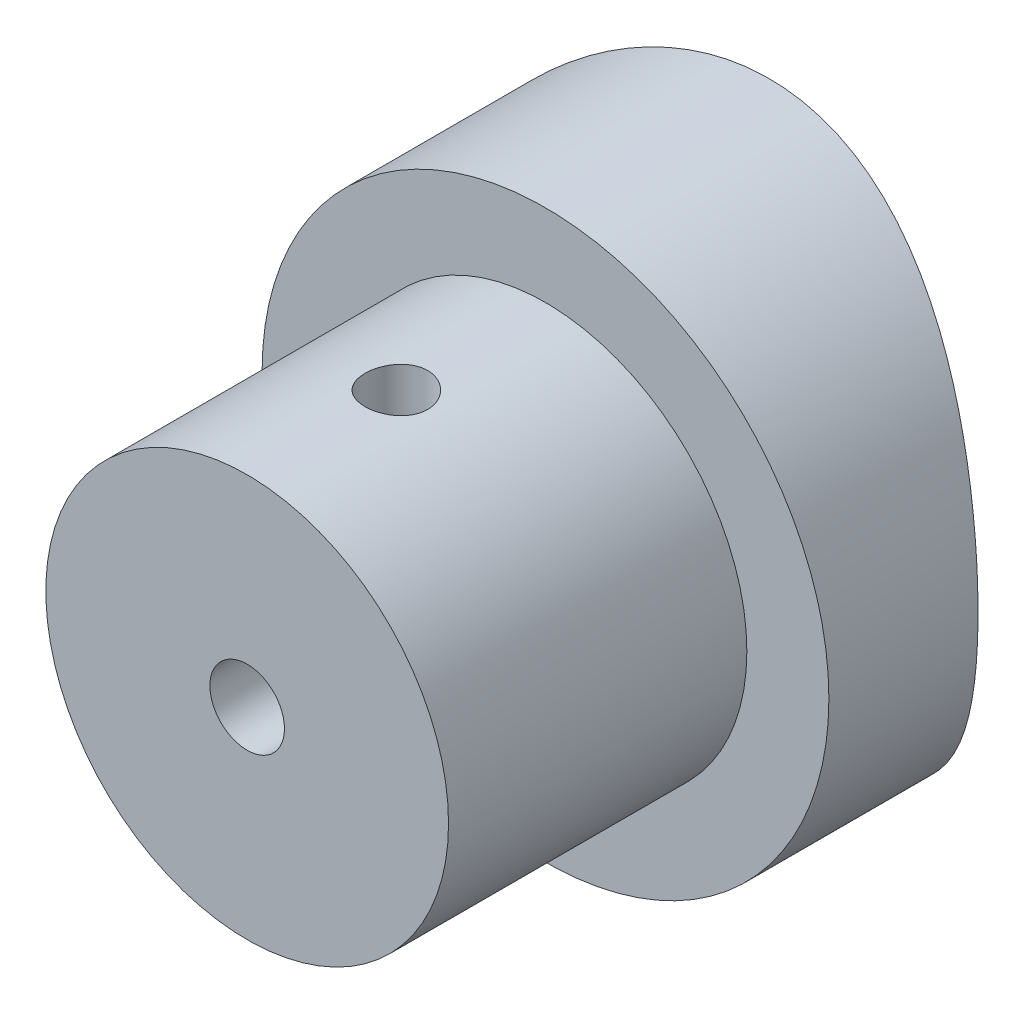
from build123d import *

# Parameters (mm, degrees)
ESBO_O1_R                  = 19
RESSALTO_EXTRUS_O1_DEPTH   = 7.5
CORTE_EXTRUS_O1_DEPTH      = 28.897132469
CORTE_EXTRUS_O1_DEPTH_BACK = 28.897132469
ESBO_O3_R                  = 13.5
RESSALTO_EXTRUS_O2_DEPTH   = 20
FURO_ROSCADO_DE_M61_D      = 5
FURO_ROSCADO_DE_M51_D      = 4.2
FURO_ROSCADO_DE_M51_DEPTH  = 10
FURO_ROSCADO_DE_M51_TIP    = 1.2618073


with BuildPart() as part:
    # Esboço1 → Ressalto-extrusão1 (new, symmetric)
    with BuildSketch(Plane.XY):
        Circle(ESBO_O1_R)
    extrude(amount=RESSALTO_EXTRUS_O1_DEPTH, both=True)

    # Esboço2 → Corte-extrusão1 (cut, two sides: drawn at the far end of the back side and taken through both)
    with BuildSketch(Plane(origin=(0, 0, 0), x_dir=(1, 0, 0), z_dir=(0, 1, 0)).offset(-CORTE_EXTRUS_O1_DEPTH_BACK)):
        with BuildLine():
            Line((-96.112462059, -41.105261283), (-19, 2.5))
            ThreePointArc((-19, 2.5), (0, 7.5), (19, 2.5))
            Line((19, 2.5), (96.112462059, -41.105261283))
            Line((96.112462059, -41.105261283), (96.112462059, 136.069800352))
            Line((96.112462059, 136.069800352), (-96.112462059, 136.069800352))
            Line((-96.112462059, 136.069800352), (-96.112462059, -41.105261283))
        make_face()
    extrude(amount=CORTE_EXTRUS_O1_DEPTH + CORTE_EXTRUS_O1_DEPTH_BACK, mode=Mode.SUBTRACT)

    # Esboço3 → Ressalto-extrusão2 (add)
    with BuildSketch(Plane.XY.offset(7.5)):
        Circle(ESBO_O3_R)
    extrude(amount=RESSALTO_EXTRUS_O2_DEPTH)

    # Furo roscado de M61 (through all)
    with Locations(Plane.XY.offset(27.5)):
        with Locations((0, 0)):
            Hole(FURO_ROSCADO_DE_M61_D / 2)

    # Furo roscado de M51
    with Locations(Plane(origin=(0, 14, 0), x_dir=(1, 0, 0), z_dir=(0, 1, 0))):
        with Locations((0, -17.5)):
            Hole(FURO_ROSCADO_DE_M51_D / 2, depth=FURO_ROSCADO_DE_M51_DEPTH)
            with Locations((0, 0, -(FURO_ROSCADO_DE_M51_DEPTH + FURO_ROSCADO_DE_M51_TIP / 2))):  # 118° drill point
                Cone(0, FURO_ROSCADO_DE_M51_D / 2, FURO_ROSCADO_DE_M51_TIP, mode=Mode.SUBTRACT)


solid = part.part
